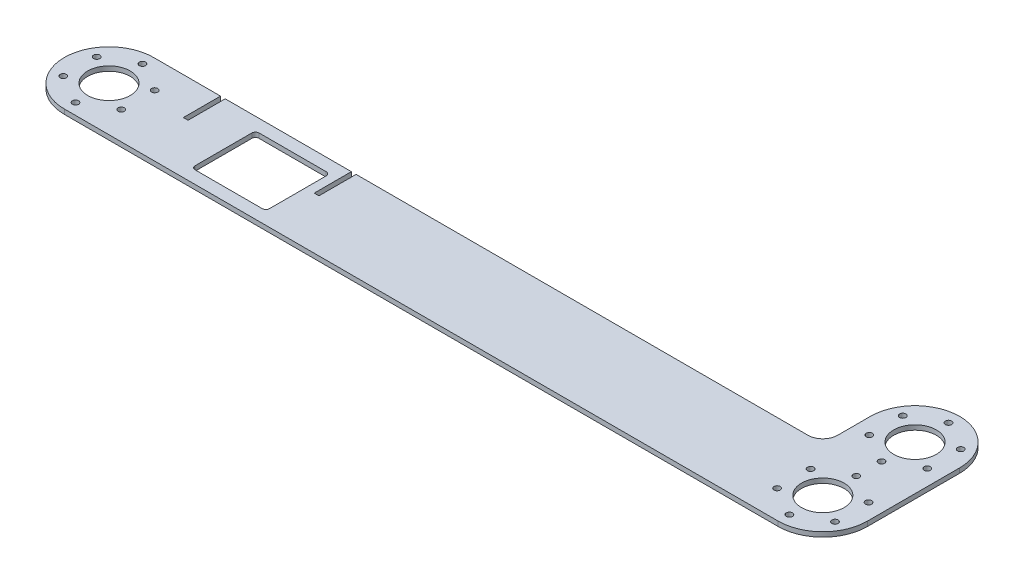
from build123d import *

# Parameters (mm, degrees)
BOSS_EXTRUDE1_DEPTH = 3.175
SKETCH2_R           = 14.3
CUT_EXTRUDE1_DEPTH  = 293.296998547
SKETCH4_R           = 2.1
CUT_EXTRUDE2_DEPTH  = 293.296998547
SKETCH6_W           = 3.175
SKETCH6_H           = 25
CUT_EXTRUDE3_DEPTH  = 10
CUT_EXTRUDE6_DEPTH  = 10
SKETCH10_W          = 3.175
SKETCH10_H          = 25
CUT_EXTRUDE7_DEPTH  = 6.35


with BuildPart() as part:
    # Sketch1 → Boss-Extrude1 (new body)
    with BuildSketch(Plane(origin=(0, 0, 0), x_dir=(1, 0, 0), z_dir=(0, 1, 0))):
        with BuildLine():
            Line((277.741935484, -0.967741935), (277.741935484, 61.032258065))
            ThreePointArc((277.741935484, 61.032258065), (247.741935484, 91.032258065), (217.741935484, 61.032258065))
            Line((217.741935484, 61.032258065), (217.741935484, 39.032258065))
            ThreePointArc((217.741935484, 39.032258065), (214.813003296, 31.961190253), (207.741935484, 29.032258065))
            Line((207.741935484, 29.032258065), (-232.258064516, 29.032258065))
            ThreePointArc((-232.258064516, 29.032258065), (-262.258064516, -0.967741935), (-232.258064516, -30.967741935))
            Line((-232.258064516, -30.967741935), (247.741935484, -30.967741935))
            ThreePointArc((247.741935484, -30.967741935), (268.955138919, -22.180945371), (277.741935484, -0.967741935))
        make_face()
    extrude(amount=BOSS_EXTRUDE1_DEPTH)

    # Sketch2 → Cut-Extrude1 (cut, through all)
    with BuildSketch(Plane(origin=(0, 3.175, 0), x_dir=(1, 0, 0), z_dir=(0, 1, 0))):
        with Locations(Location((-232.258064516, -0.967741935, 0), (0, 0, 270))):
            Circle(SKETCH2_R)
        with Locations(Location((247.741935484, -0.967741935, 0), (0, 0, 270))):
            Circle(SKETCH2_R)
        with Locations(Location((247.741935484, 61.032258065, 0), (0, 0, 270))):
            Circle(SKETCH2_R)
    extrude(amount=-CUT_EXTRUDE1_DEPTH, mode=Mode.SUBTRACT)

    # Sketch4 → Cut-Extrude2 (cut, through all)
    with BuildSketch(Plane(origin=(0, 3.175, 0), x_dir=(1, 0, 0), z_dir=(0, 1, 0))):
        with Locations(Location((-232.258064516, 21.532258065, 0), (0, 0, 270))):
            Circle(SKETCH4_R)
        with Locations(Location((-212.772492931, 10.282258065, 0), (0, 0, 270))):
            Circle(SKETCH4_R)
        with Locations(Location((-212.772492931, -12.217741935, 0), (0, 0, 270))):
            Circle(SKETCH4_R)
        with Locations(Location((-232.258064516, -23.467741935, 0), (0, 0, 270))):
            Circle(SKETCH4_R)
        with Locations(Location((247.741935484, 83.532258065, 0), (0, 0, 270))):
            Circle(SKETCH4_R)
        with Locations(Location((247.741935484, 21.532258065, 0), (0, 0, 270))):
            Circle(SKETCH4_R)
        with Locations(Location((267.227507069, 72.282258065, 0), (0, 0, 270))):
            Circle(SKETCH4_R)
        with Locations(Location((267.227507069, 49.782258065, 0), (0, 0, 270))):
            Circle(SKETCH4_R)
        with Locations(Location((247.741935484, 38.532258065, 0), (0, 0, 270))):
            Circle(SKETCH4_R)
        with Locations(Location((267.227507069, 10.282258065, 0), (0, 0, 270))):
            Circle(SKETCH4_R)
        with Locations(Location((267.227507069, -12.217741935, 0), (0, 0, 270))):
            Circle(SKETCH4_R)
        with Locations(Location((247.741935484, -23.467741935, 0), (0, 0, 270))):
            Circle(SKETCH4_R)
        with Locations(Location((-251.743636101, -12.217741935, 0), (0, 0, 270))):
            Circle(SKETCH4_R)
        with Locations(Location((-251.743636101, 10.282258065, 0), (0, 0, 270))):
            Circle(SKETCH4_R)
        with Locations(Location((228.256363899, -12.217741935, 0), (0, 0, 270))):
            Circle(SKETCH4_R)
        with Locations(Location((228.256363899, 10.282258065, 0), (0, 0, 270))):
            Circle(SKETCH4_R)
        with Locations(Location((228.256363899, 49.782258065, 0), (0, 0, 270))):
            Circle(SKETCH4_R)
        with Locations(Location((228.256363899, 72.282258065, 0), (0, 0, 270))):
            Circle(SKETCH4_R)
    extrude(amount=-CUT_EXTRUDE2_DEPTH, mode=Mode.SUBTRACT)

    # Sketch6 → Cut-Extrude3 (cut)
    with BuildSketch(Plane(origin=(0, 3.175, 0), x_dir=(1, 0, 0), z_dir=(0, 1, 0))):
        with Locations((-185.670564516, 16.532258065)):
            Rectangle(SKETCH6_W, SKETCH6_H)
    extrude(amount=-CUT_EXTRUDE3_DEPTH, mode=Mode.SUBTRACT)

    # Sketch9 → Cut-Extrude6 (cut)
    with BuildSketch(Plane(origin=(0, 3.175, 0), x_dir=(1, 0, 0), z_dir=(0, 1, 0))):
        with BuildLine():
            Line((-148.258064516, -22.467741935), (-107.689679667, -22.467741935))
            ThreePointArc((-107.689679667, -22.467741935), (-105.970268104, -21.755538347), (-105.258064516, -20.036126785))
            Line((-105.258064516, -20.036126785), (-105.258064516, 18.100642914))
            ThreePointArc((-105.258064516, 18.100642914), (-105.970268104, 19.820054476), (-107.689679667, 20.532258065))
            Line((-107.689679667, 20.532258065), (-148.258064516, 20.532258065))
            Line((-148.258064516, 20.532258065), (-152.826449366, 20.532258065))
            ThreePointArc((-152.826449366, 20.532258065), (-154.545860928, 19.820054476), (-155.258064516, 18.100642914))
            Line((-155.258064516, 18.100642914), (-155.258064516, -20.036126785))
            ThreePointArc((-155.258064516, -20.036126785), (-154.545860928, -21.755538347), (-152.826449366, -22.467741935))
            Line((-152.826449366, -22.467741935), (-148.258064516, -22.467741935))
        make_face()
    extrude(amount=-CUT_EXTRUDE6_DEPTH, mode=Mode.SUBTRACT)

    # Sketch10 → Cut-Extrude7 (cut)
    with BuildSketch(Plane(origin=(0, 3.175, 0), x_dir=(1, 0, 0), z_dir=(0, 1, 0))):
        with Locations((-97.670564516, 16.532258065)):
            Rectangle(SKETCH10_W, SKETCH10_H)
    extrude(amount=-CUT_EXTRUDE7_DEPTH, mode=Mode.SUBTRACT)


solid = part.part
